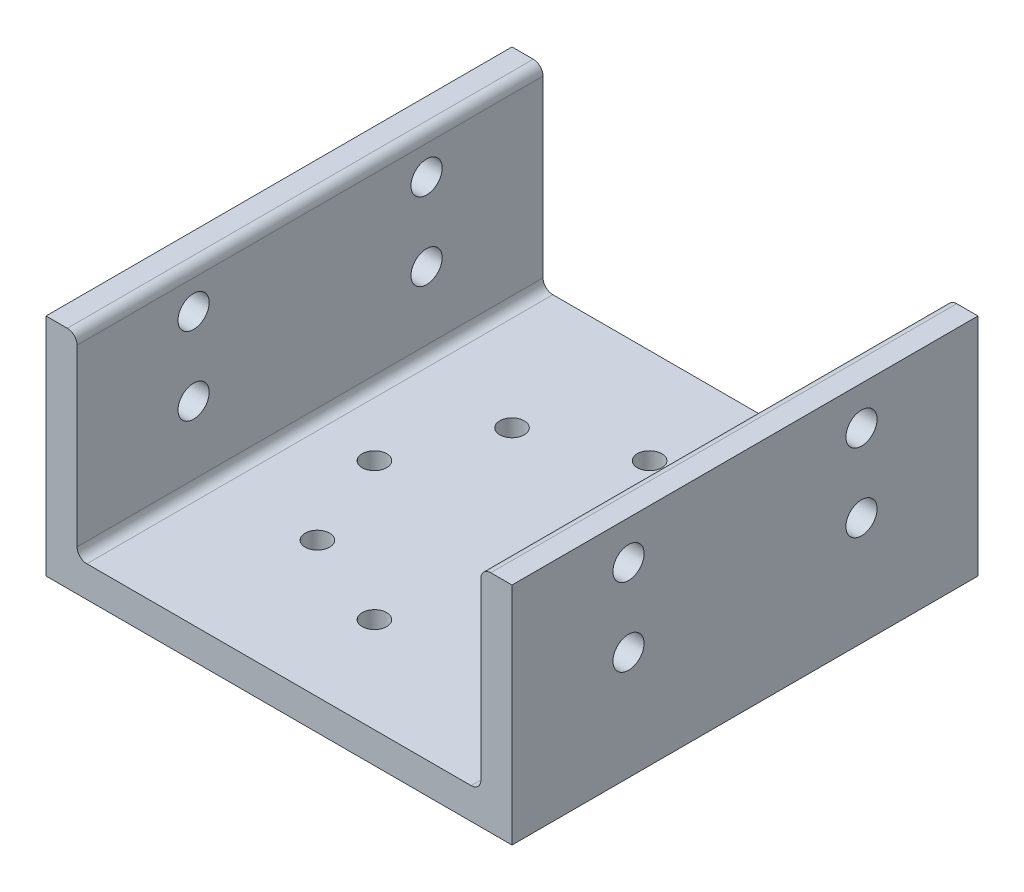
from build123d import *

# Parameters (mm, degrees)
BOSS_EXTRUDE1_DEPTH = 76.2
FILLET1_R           = 1.6
SKETCH2_R           = 2
CUT_EXTRUDE2_DEPTH  = 93.814324864
SKETCH3_R           = 2.55
CUT_EXTRUDE3_DEPTH  = 114.882961412


with BuildPart() as part:
    # Sketch1 → Boss-Extrude1 (new body)
    with BuildSketch(Plane.XY):
        Polygon((-38.1, 0), (38.1, 0), (38.1, 3.175), (38.1, 36.83), (33.02, 36.83), (33.02, 5.08), (-33.02, 5.08), (-33.02, 36.83), (-38.1, 36.83), (-38.1, 4.389392044), align=None)
    extrude(amount=BOSS_EXTRUDE1_DEPTH)

    # Fillet1
    fillet1_edges = [part.edges().sort_by_distance(p)[0] for p in [
        (-33.02, 36.83, 38.1),
        (-33.02, 5.08, 38.1),
        (33.02, 5.08, 38.1),
        (33.02, 36.83, 38.1),
    ]]
    fillet(fillet1_edges, radius=FILLET1_R)

    # Sketch2 → Cut-Extrude2 (cut, through all)
    with BuildSketch(Plane.XZ):
        with Locations(Location((0, 60.6, 0), (0, 0, 270))):
            Circle(SKETCH2_R)
        with Locations(Location((15.909902577, 54.009902577, 0), (0, 0, 270))):
            Circle(SKETCH2_R)
        with Locations(Location((22.5, 38.1, 0), (0, 0, 270))):
            Circle(SKETCH2_R)
        with Locations(Location((15.909902577, 22.190097423, 0), (0, 0, 270))):
            Circle(SKETCH2_R)
        with Locations(Location((0, 15.6, 0), (0, 0, 270))):
            Circle(SKETCH2_R)
        with Locations(Location((-15.909902577, 22.190097423, 0), (0, 0, 270))):
            Circle(SKETCH2_R)
        with Locations(Location((-22.5, 38.1, 0), (0, 0, 270))):
            Circle(SKETCH2_R)
        with Locations(Location((-15.909902577, 54.009902577, 0), (0, 0, 270))):
            Circle(SKETCH2_R)
    extrude(amount=-CUT_EXTRUDE2_DEPTH, mode=Mode.SUBTRACT)

    # Sketch3 → Cut-Extrude3 (cut, through all)
    with BuildSketch(Plane.ZY.offset(38.1)):
        with Locations((19.05, 30.48)):
            Circle(SKETCH3_R)
        with Locations((19.05, 17.78)):
            Circle(SKETCH3_R)
        with Locations((57.15, 17.78)):
            Circle(SKETCH3_R)
        with Locations((57.15, 30.48)):
            Circle(SKETCH3_R)
    extrude(amount=-CUT_EXTRUDE3_DEPTH, mode=Mode.SUBTRACT)


solid = part.part
